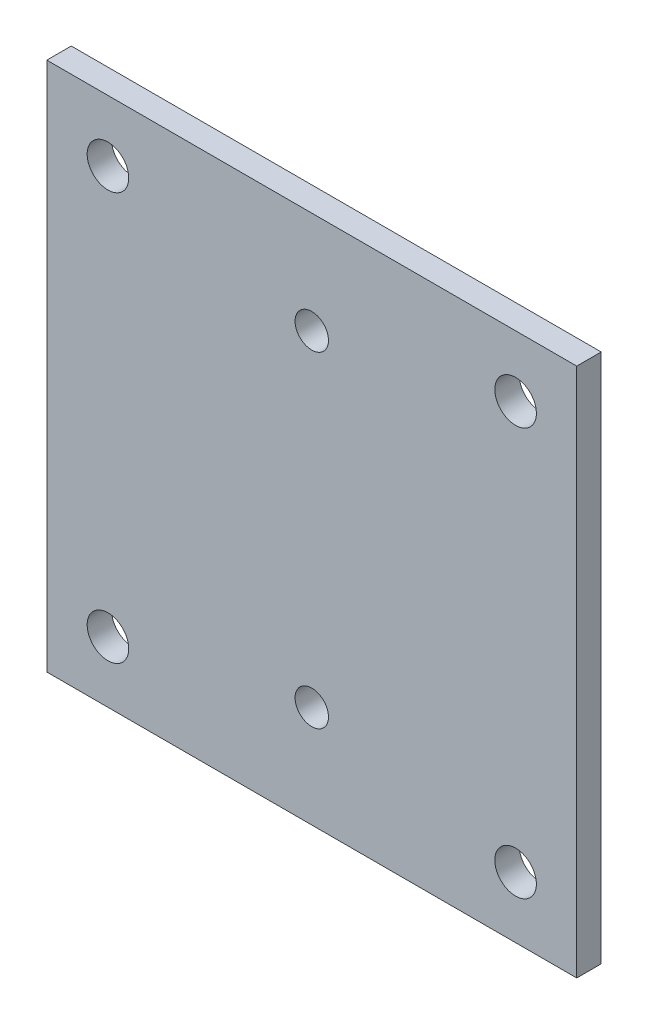
from build123d import *

# Parameters (mm, degrees)
SKETCH1_W           = 65
SKETCH1_H           = 65
SKETCH1_R           = 2.55
SKETCH1_R_2         = 2.05
BOSS_EXTRUDE1_DEPTH = 3


with BuildPart() as part:
    # Sketch1 → Boss-Extrude1 (new body)
    with BuildSketch(Plane.XY):
        Rectangle(SKETCH1_W, SKETCH1_H)
        with Locations((-25, 25)):
            Circle(SKETCH1_R, mode=Mode.SUBTRACT)
        with Locations((25, 25)):
            Circle(SKETCH1_R, mode=Mode.SUBTRACT)
        with Locations((-25, -25)):
            Circle(SKETCH1_R, mode=Mode.SUBTRACT)
        with Locations((25, -25)):
            Circle(SKETCH1_R, mode=Mode.SUBTRACT)
        with Locations((0, 20)):
            Circle(SKETCH1_R_2, mode=Mode.SUBTRACT)
        with Locations((0, -20)):
            Circle(SKETCH1_R_2, mode=Mode.SUBTRACT)
    extrude(amount=BOSS_EXTRUDE1_DEPTH)


solid = part.part
